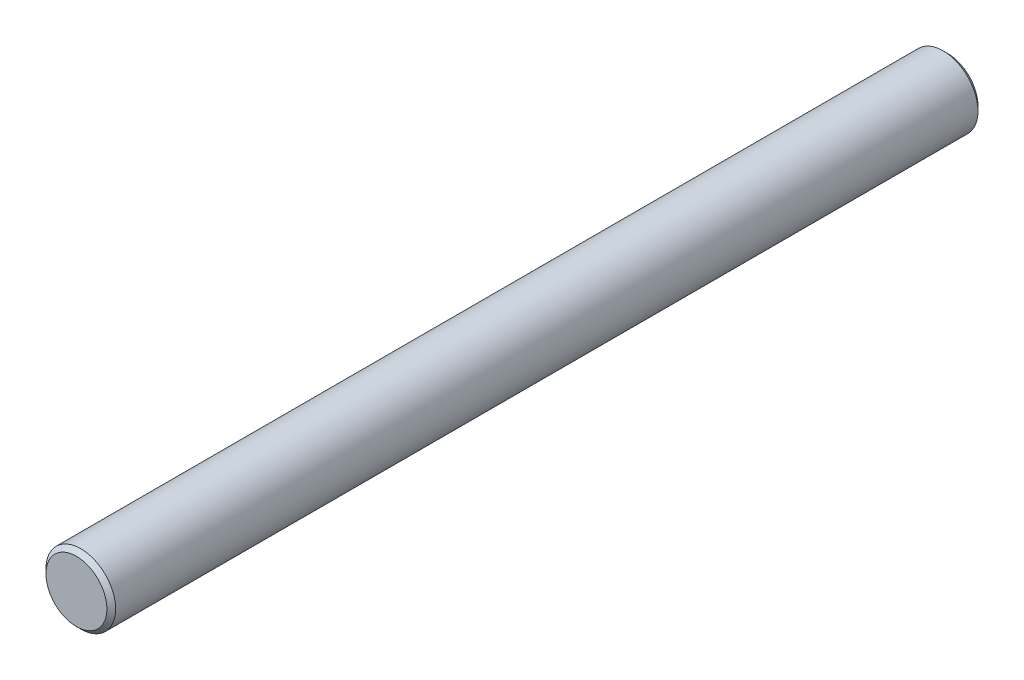
from build123d import *

# Parameters (mm, degrees)
SKETCH1_R           = 4
BOSS_EXTRUDE1_DEPTH = 100
CHAMFER1_SIZE       = 0.5


with BuildPart() as part:
    # Sketch1 → Boss-Extrude1 (new body)
    with BuildSketch(Plane.XY):
        Circle(SKETCH1_R)
    extrude(amount=BOSS_EXTRUDE1_DEPTH)

    # Chamfer1
    chamfer1_edges = [part.edges().sort_by_distance(p)[0] for p in [
        (-4, 0, 0),
        (-4, 0, 100),
    ]]
    chamfer(chamfer1_edges, length=CHAMFER1_SIZE)


solid = part.part
